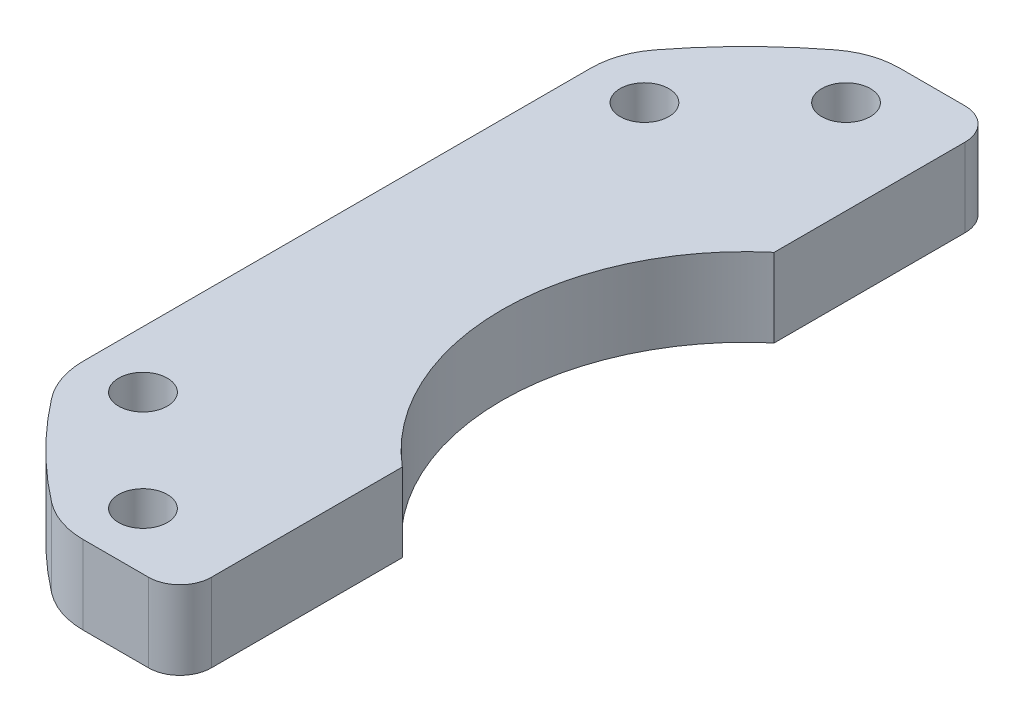
from build123d import *

# Parameters (mm, degrees)
SKETCH_1_R          = 15.5
SKETCH_1_R_2        = 1.55
EXTRUDE_1_DEPTH     = 5
SKETCH_3_W          = 44.726871009
SKETCH_3_H          = 71.780776613
CUT_EXTRUDE_2_DEPTH = 10
FILLET_1_R          = 2
FILLET_2_R          = 5


with BuildPart() as part:
    # 草图1 → 凸台-拉伸1 (new body)
    with BuildSketch(Plane(origin=(0, 0, 0), x_dir=(1, 0, 0), z_dir=(0, 1, 0))):
        with BuildLine():
            Line((-17.783419244, 26), (17.783419244, 26))
            ThreePointArc((17.783419244, 26), (22.273863607, 22.273863607), (26, 17.783419244))
            Line((26, 17.783419244), (26, -17.783419244))
            ThreePointArc((26, -17.783419244), (22.273863607, -22.273863607), (17.783419244, -26))
            Line((17.783419244, -26), (-17.783419244, -26))
            ThreePointArc((-17.783419244, -26), (-22.273863607, -22.273863607), (-26, -17.783419244))
            Line((-26, -17.783419244), (-26, 17.783419244))
            ThreePointArc((-26, 17.783419244), (-22.273863607, 22.273863607), (-17.783419244, 26))
        make_face()
        with Locations(Location((0, 0, 0), (0, 0, 270))):
            Circle(SKETCH_1_R, mode=Mode.SUBTRACT)
        with Locations(Location((-22.388176755, 15.969331282, 0), (0, 0, 270))):
            Circle(SKETCH_1_R_2, mode=Mode.SUBTRACT)
        with Locations(Location((-15.969331282, 22.388176755, 0), (0, 0, 90))):
            Circle(SKETCH_1_R_2, mode=Mode.SUBTRACT)
        with Locations(Location((22.388176755, 15.969331282, 0), (0, 0, 90))):
            Circle(SKETCH_1_R_2, mode=Mode.SUBTRACT)
        with Locations(Location((15.969331282, 22.388176755, 0), (0, 0, 270))):
            Circle(SKETCH_1_R_2, mode=Mode.SUBTRACT)
        with Locations(Location((22.388176755, -15.969331282, 0), (0, 0, 270))):
            Circle(SKETCH_1_R_2, mode=Mode.SUBTRACT)
        with Locations(Location((15.969331282, -22.388176755, 0), (0, 0, 90))):
            Circle(SKETCH_1_R_2, mode=Mode.SUBTRACT)
        with Locations(Location((-22.388176755, -15.969331282, 0), (0, 0, 90))):
            Circle(SKETCH_1_R_2, mode=Mode.SUBTRACT)
        with Locations(Location((-15.969331282, -22.388176755, 0), (0, 0, 270))):
            Circle(SKETCH_1_R_2, mode=Mode.SUBTRACT)
    extrude(amount=EXTRUDE_1_DEPTH)

    # 草图3 → 切除-拉伸2 (cut)
    with BuildSketch(Plane(origin=(0, 5, 0), x_dir=(1, 0, 0), z_dir=(0, 1, 0))):
        with Locations((12.363435504, 5.528436561)):
            Rectangle(SKETCH_3_W, SKETCH_3_H)
    extrude(amount=-CUT_EXTRUDE_2_DEPTH, mode=Mode.SUBTRACT)

    # 圆角1
    fillet_1_edges = [part.edges().sort_by_distance(p)[0] for p in [
        (-10, 2.5, -26),
        (-10, 2.5, 26),
    ]]
    fillet(fillet_1_edges, radius=FILLET_1_R)

    # 圆角2
    fillet_2_edges = [part.edges().sort_by_distance(p)[0] for p in [
        (-17.783419244, 2.5, -26),
        (-17.783419244, 2.5, 26),
        (-26, 2.5, 17.783419244),
        (-26, 2.5, -17.783419244),
    ]]
    fillet(fillet_2_edges, radius=FILLET_2_R)


solid = part.part
